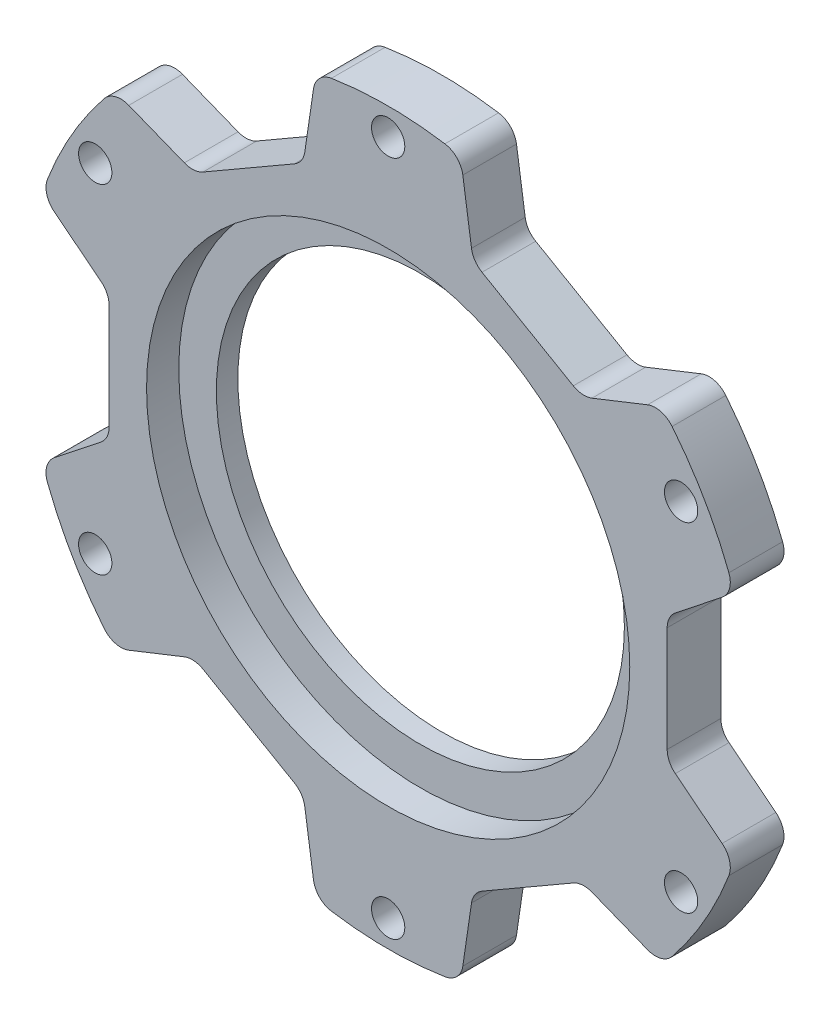
from build123d import *

# Parameters (mm, degrees)
SKETCH_1_R          = 34
SKETCH_1_R_2        = 19
EXTRUDE_1_DEPTH     = 5
SKETCH_2_R          = 22.5
CUT_EXTRUDE_1_DEPTH = 3
SKETCH_3_R          = 1.55
CUT_EXTRUDE_2_DEPTH = 13
CUT_EXTRUDE_3_DEPTH = 13
FILLET_1_R          = 2


with BuildPart() as part:
    # 草图1 → 凸台-拉伸1 (new body)
    with BuildSketch(Plane.XY):
        Circle(SKETCH_1_R)
        Circle(SKETCH_1_R_2, mode=Mode.SUBTRACT)
    extrude(amount=EXTRUDE_1_DEPTH)

    # 草图2 → 切除-拉伸1 (cut)
    with BuildSketch(Plane.XY.offset(5)):
        Circle(SKETCH_2_R)
    extrude(amount=-CUT_EXTRUDE_1_DEPTH, mode=Mode.SUBTRACT)

    # 草图3 → 切除-拉伸2 (cut)
    with BuildSketch(Plane(origin=(0, 0, 0), x_dir=(-1, 0, 0), z_dir=(0, 0, -1))):
        with Locations((0, 31.5)):
            Circle(SKETCH_3_R)
        with Locations((27.279800219, 15.75)):
            Circle(SKETCH_3_R)
        with Locations((27.279800219, -15.75)):
            Circle(SKETCH_3_R)
        with Locations((0, -31.5)):
            Circle(SKETCH_3_R)
        with Locations((-27.279800219, -15.75)):
            Circle(SKETCH_3_R)
        with Locations((-27.279800219, 15.75)):
            Circle(SKETCH_3_R)
    extrude(amount=-CUT_EXTRUDE_2_DEPTH, mode=Mode.SUBTRACT)

    # 草图4 → 切除-拉伸3 (cut)
    with BuildSketch(Plane(origin=(0, 0, 0), x_dir=(-1, 0, 0), z_dir=(0, 0, -1))):
        with BuildLine():
            Line((-6.743785591, 33.324485831), (-7.903231695, 25.440443793))
            Line((-7.903231695, 25.440443793), (-18.080454761, 19.564621316))
            Line((-18.080454761, 19.564621316), (-25.487958502, 22.502532555))
            ThreePointArc((-25.487958502, 22.502532555), (-17, 29.444863729), (-6.743785591, 33.324485831))
        make_face()
        with BuildLine():
            Line((6.743785591, 33.324485831), (7.903231695, 25.440443793))
            Line((7.903231695, 25.440443793), (18.080454761, 19.564621316))
            Line((18.080454761, 19.564621316), (25.487958502, 22.502532555))
            ThreePointArc((25.487958502, 22.502532555), (17, 29.444863729), (6.743785591, 33.324485831))
        make_face()
        with BuildLine():
            Line((32.231744093, 10.821953276), (25.983686456, 5.875822477))
            Line((25.983686456, 5.875822477), (25.983686456, -5.875822477))
            Line((25.983686456, -5.875822477), (32.231744093, -10.821953276))
            ThreePointArc((32.231744093, -10.821953276), (34, 0), (32.231744093, 10.821953276))
        make_face()
        with BuildLine():
            Line((25.487958502, -22.502532555), (18.080454761, -19.564621316))
            Line((18.080454761, -19.564621316), (7.903231695, -25.440443793))
            Line((7.903231695, -25.440443793), (6.743785591, -33.324485831))
            ThreePointArc((6.743785591, -33.324485831), (17, -29.444863729), (25.487958502, -22.502532555))
        make_face()
        with BuildLine():
            Line((-6.743785591, -33.324485831), (-7.903231695, -25.440443793))
            Line((-7.903231695, -25.440443793), (-18.080454761, -19.564621316))
            Line((-18.080454761, -19.564621316), (-25.487958502, -22.502532555))
            ThreePointArc((-25.487958502, -22.502532555), (-17, -29.444863729), (-6.743785591, -33.324485831))
        make_face()
        with BuildLine():
            Line((-32.231744093, -10.821953276), (-25.983686456, -5.875822477))
            Line((-25.983686456, -5.875822477), (-25.983686456, 5.875822477))
            Line((-25.983686456, 5.875822477), (-32.231744093, 10.821953276))
            ThreePointArc((-32.231744093, 10.821953276), (-34, 0), (-32.231744093, -10.821953276))
        make_face()
    extrude(amount=-CUT_EXTRUDE_3_DEPTH, mode=Mode.SUBTRACT)

    # 圆角1
    fillet_1_edges = [part.edges().sort_by_distance(p)[0] for p in [
        (-25.983686456, -5.875822477, 2.5),
        (-25.983686456, 5.875822477, 2.5),
        (7.903231695, 25.440443793, 2.5),
        (18.080454761, 19.564621316, 2.5),
        (-18.080454761, 19.564621316, 2.5),
        (-7.903231695, 25.440443793, 2.5),
        (-6.743785591, 33.324485831, 2.5),
        (-25.487958502, 22.502532555, 2.5),
        (25.487958502, 22.502532555, 2.5),
        (6.743785591, 33.324485831, 2.5),
        (-32.231744093, 10.821953276, 2.5),
        (-32.231744093, -10.821953276, 2.5),
        (-25.487958502, -22.502532555, 2.5),
        (-6.743785591, -33.324485831, 2.5),
        (6.743785591, -33.324485831, 2.5),
        (25.487958502, -22.502532555, 2.5),
        (32.231744093, -10.821953276, 2.5),
        (32.231744093, 10.821953276, 2.5),
        (25.983686456, 5.875822477, 2.5),
        (25.983686456, -5.875822477, 2.5),
        (18.080454761, -19.564621316, 2.5),
        (7.903231695, -25.440443793, 2.5),
        (-7.903231695, -25.440443793, 2.5),
        (-18.080454761, -19.564621316, 2.5),
    ]]
    fillet(fillet_1_edges, radius=FILLET_1_R)


solid = part.part
